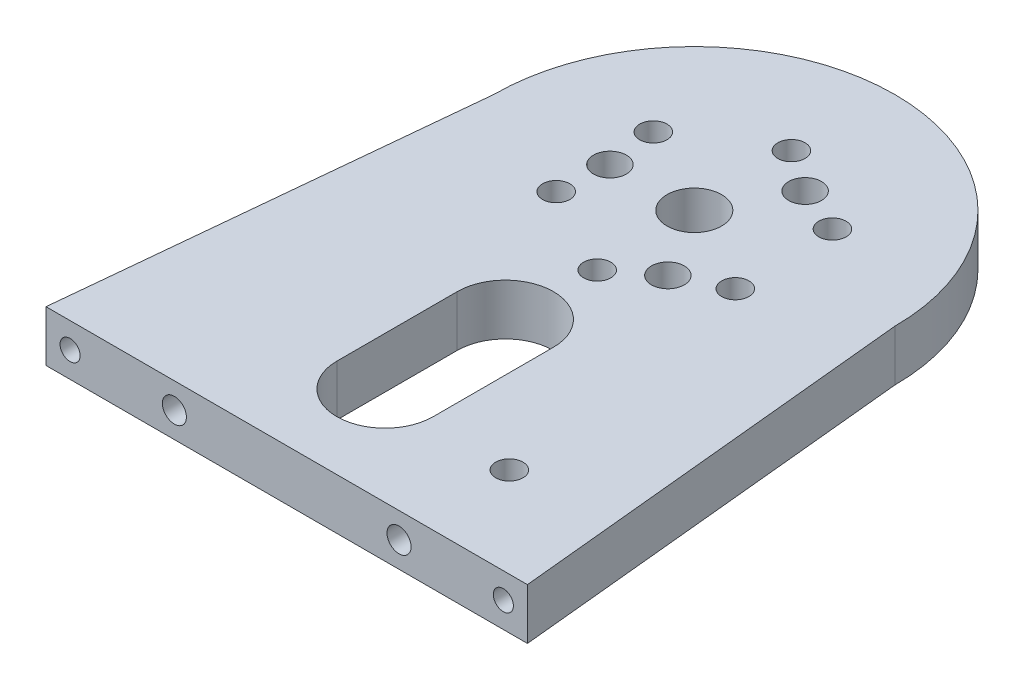
from build123d import *

# Parameters (mm, degrees)
PLACA_ANTEBRAZO_START          = -3.175
PLACA_ANTEBRAZO_DEPTH          = 6.35
PLACA_ANTEBRAZO_REDONDEO_START = -3.175
CROQUIS13_R                    = 25
PLACA_ANTEBRAZO_REDONDEO_DEPTH = 6.35
BARRENOS_J3_START              = -3.175
CROQUIS14_R                    = 1.7
CROQUIS14_R_2                  = 2.05
CROQUIS14_R_3                  = 3.4
BARRENOS_J3_DEPTH              = 6.35
REFRENTADOS_J3_START           = -3.175
CROQUIS15_R                    = 3
REFRENTADOS_J3_DEPTH           = 3.2
ALIGERADO_PASO_CABLE_START     = -3.175
ALIGERADO_PASO_CABLE_DEPTH     = 6.35
ROSCA_M3_CANTO_START           = 213.25
CROQUIS17_R                    = 1.25
ROSCA_M3_CANTO_DEPTH           = 9
PASADORES_D3_START             = 215.25
CROQUIS18_R                    = 1.5
PASADORES_D3_DEPTH             = 7
PASO_M3_BASES_CINCHO_START     = -3.175
CROQUIS20_R                    = 1.7
PASO_M3_BASES_CINCHO_DEPTH     = 6.35


with BuildPart() as part:
    # Croquis12 → Placa_antebrazo (new body)
    with BuildSketch(Plane(origin=(0, 0, 0), x_dir=(1, 0, 0), z_dir=(0, 1, 0)).offset(PLACA_ANTEBRAZO_START)):
        Polygon((127.4, -171.45), (177.4, -171.45), (182.4, -222.25), (122.4, -222.25), align=None)
    extrude(amount=PLACA_ANTEBRAZO_DEPTH)

    # Croquis13 → Placa_antebrazo_redondeo (add)
    with BuildSketch(Plane(origin=(0, 0, 0), x_dir=(1, 0, 0), z_dir=(0, 1, 0)).offset(PLACA_ANTEBRAZO_REDONDEO_START)):
        with Locations((152.4, -171.45)):
            Circle(CROQUIS13_R)
    extrude(amount=PLACA_ANTEBRAZO_REDONDEO_DEPTH)

    # Croquis14 → Barrenos_J3 (cut)
    with BuildSketch(Plane(origin=(0, 0, 0), x_dir=(1, 0, 0), z_dir=(0, 1, 0)).offset(BARRENOS_J3_START)):
        with Locations((163.416293151, -177.356884561)):
            Circle(CROQUIS14_R)
        with Locations((152.792634488, -183.943832005)):
            Circle(CROQUIS14_R)
        with Locations((141.776341338, -178.036947444)):
            Circle(CROQUIS14_R)
        with Locations((141.383706849, -165.543115439)):
            Circle(CROQUIS14_R)
        with Locations((152.007365512, -158.956167995)):
            Circle(CROQUIS14_R)
        with Locations((163.023658662, -164.863052556)):
            Circle(CROQUIS14_R)
        with Locations((157.774949114, -180.118905468)):
            Circle(CROQUIS14_R_2)
        with Locations((142.205033084, -171.770389743)):
            Circle(CROQUIS14_R_2)
        with Locations((157.220017802, -162.460704789)):
            Circle(CROQUIS14_R_2)
        with Locations((152.4, -171.45)):
            Circle(CROQUIS14_R_3)
    extrude(amount=BARRENOS_J3_DEPTH, mode=Mode.SUBTRACT)

    # Croquis15 → Refrentados_J3 (cut)
    with BuildSketch(Plane(origin=(0, 0, 0), x_dir=(1, 0, 0), z_dir=(0, 1, 0)).offset(REFRENTADOS_J3_START)):
        with Locations((163.416293151, -177.356884561)):
            Circle(CROQUIS15_R)
        with Locations((152.792634488, -183.943832005)):
            Circle(CROQUIS15_R)
        with Locations((141.776341338, -178.036947444)):
            Circle(CROQUIS15_R)
        with Locations((141.383706849, -165.543115439)):
            Circle(CROQUIS15_R)
        with Locations((152.007365512, -158.956167995)):
            Circle(CROQUIS15_R)
        with Locations((163.023658662, -164.863052556)):
            Circle(CROQUIS15_R)
    extrude(amount=REFRENTADOS_J3_DEPTH, mode=Mode.SUBTRACT)

    # Croquis16 → Aligerado_paso_cable (cut)
    with BuildSketch(Plane(origin=(0, 0, 0), x_dir=(1, 0, 0), z_dir=(0, 1, 0)).offset(ALIGERADO_PASO_CABLE_START)):
        with BuildLine():
            Line((158.4, -195), (158.4, -210))
            ThreePointArc((158.4, -210), (152.4, -216), (146.4, -210))
            Line((146.4, -210), (146.4, -195))
            ThreePointArc((146.4, -195), (152.4, -189), (158.4, -195))
        make_face()
    extrude(amount=ALIGERADO_PASO_CABLE_DEPTH, mode=Mode.SUBTRACT)

    # Croquis17 → Rosca_M3_canto (cut)
    with BuildSketch(Plane.XY.offset(ROSCA_M3_CANTO_START)):
        with Locations((125.4, 0)):
            Circle(CROQUIS17_R)
        with Locations((179.4, 0)):
            Circle(CROQUIS17_R)
    extrude(amount=ROSCA_M3_CANTO_DEPTH, mode=Mode.SUBTRACT)

    # Croquis18 → Pasadores_D3 (cut)
    with BuildSketch(Plane.XY.offset(PASADORES_D3_START)):
        with Locations((138.4, 0)):
            Circle(CROQUIS18_R)
        with Locations((166.4, 0)):
            Circle(CROQUIS18_R)
    extrude(amount=PASADORES_D3_DEPTH, mode=Mode.SUBTRACT)

    # Croquis20 → Paso_M3_bases_cincho (cut)
    with BuildSketch(Plane(origin=(0, 0, 0), x_dir=(1, 0, 0), z_dir=(0, 1, 0)).offset(PASO_M3_BASES_CINCHO_START)):
        with Locations((168.9, -211)):
            Circle(CROQUIS20_R)
    extrude(amount=PASO_M3_BASES_CINCHO_DEPTH, mode=Mode.SUBTRACT)


solid = part.part
